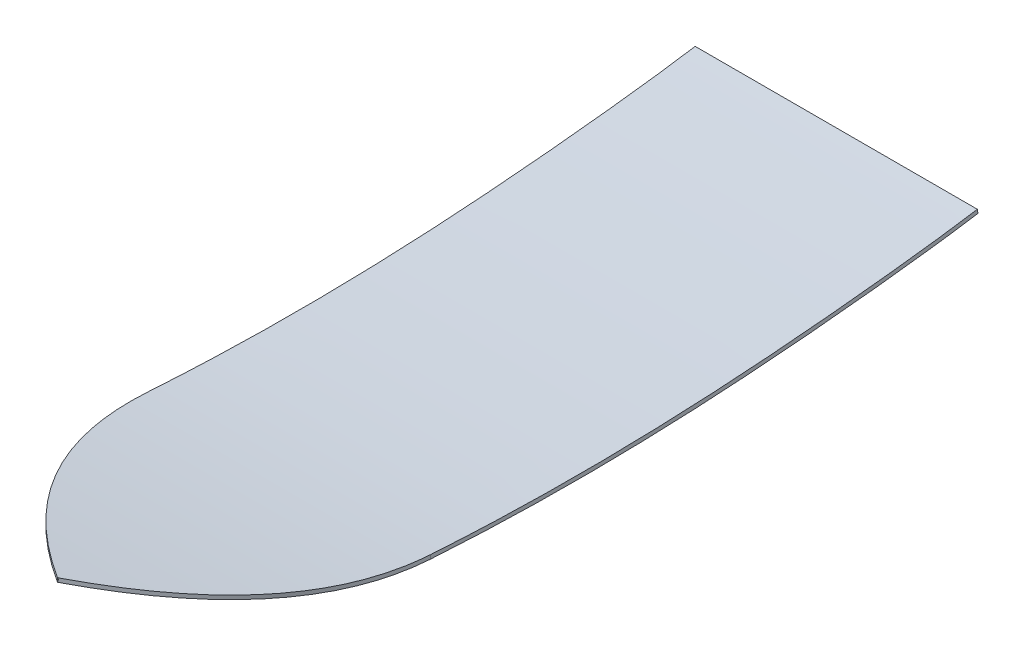
from build123d import *

# Parameters (mm, degrees)
BOSS_EXTRUDE1_DEPTH      = 1524
BOSS_EXTRUDE1_DEPTH_BACK = 1524
CUT_EXTRUDE1_DEPTH       = 4045.555232676
CUT_EXTRUDE1_DEPTH_BACK  = 4045.555232676
SKETCH3_W                = 5731.45735109
SKETCH3_H                = 8003.30588206


with BuildPart() as part:
    # Sketch1 → Boss-Extrude1 (new, two sides: drawn at the far end of the back side and taken through both)
    with BuildSketch(Plane(origin=(0, 0, 0), x_dir=(0, 0, -1), z_dir=(1, 0, 0)).offset(-BOSS_EXTRUDE1_DEPTH_BACK)):
        with BuildLine():
            Line((-3738.598348924, 39.976224385), (-3742.25554095, 15.245172113))
            add(Edge.make_bspline(
                [(-3742.25554095, 15.245172113), (-3725.535118437, 12.77258036), (-3692.108405138, 7.864272652), (-3625.081125069, -1.834737676), (-3541.2258593, -13.692342309), (-3440.832874878, -27.419661101), (-3307.81548506, -44.960095833), (-3144.009720726, -65.313134762), (-2953.851997478, -86.90871838), (-2771.660767492, -105.613608298), (-2627.128036737, -118.872843365), (-2515.948199802, -128.18745139), (-2434.744178293, -134.559022515), (-2355.713401147, -140.346054437), (-2278.724534954, -145.587189882), (-2202.959984942, -150.360148577), (-2103.436566601, -156.126098926), (-1981.389400261, -162.274499475), (-1837.600874635, -168.096757909), (-1695.574461023, -172.458706477), (-1554.543571859, -175.423410079), (-1413.822671965, -177.031022304), (-1272.806717473, -177.288564618), (-1130.885731445, -176.20268196), (-987.464309604, -173.74070399), (-841.946280225, -169.870399132), (-693.686505709, -164.526859425), (-567.265075864, -158.775674393), (-464.004662305, -153.339279499), (-385.394402347, -148.827140799), (-305.495597168, -143.861363386), (-224.132634072, -138.413188264), (-142.131592105, -132.539762269), (-32.15611158, -124.178968318), (105.905281407, -112.813198927), (270.631498183, -97.958115966), (432.472435932, -82.145845906), (589.461739236, -65.641348221), (714.583229245, -51.535715918), (810.253409693, -40.178384478), (879.541765579, -31.65843955), (946.115102109, -23.170995696), (1009.725395408, -14.750909824), (1060.058812021, -7.819198224), (1098.597377592, -2.342063803), (1126.606628964, 1.727405119), (1153.690591605, 5.754231394), (1175.464490045, 9.070928966), (1192.390191301, 11.698701882), (1204.835769764, 13.656512235), (1214.99075838, 15.275774902), (1222.99653812, 16.565774719), (1226.936863675, 17.205207674), (1228.914572093, 17.527310931)],
                knots=[0.002321773, 0.002321773, 0.002321773, 0.002321773, 0.010116134, 0.017910495, 0.033499218, 0.04908794, 0.064676662, 0.095854107, 0.127031551, 0.158208996, 0.189386441, 0.204975163, 0.220563885, 0.236152608, 0.25174133, 0.267330052, 0.282918774, 0.314096219, 0.345273664, 0.376451108, 0.407628553, 0.438805997, 0.469983442, 0.501160887, 0.532338331, 0.563515776, 0.59469322, 0.625870665, 0.641459387, 0.65704811, 0.672636832, 0.688225554, 0.703814276, 0.719402999, 0.750580443, 0.781757888, 0.812935332, 0.844112777, 0.875290222, 0.890878944, 0.906467666, 0.922056389, 0.937645111, 0.953233833, 0.961028194, 0.968822555, 0.976616917, 0.984411278, 0.988308458, 0.992205639, 0.996102819, 0.99805141, 1, 1, 1, 1], degree=3))
            Line((1228.914572093, 17.527310931), (1224.895850096, 42.202194386))
            add(Edge.make_bspline(
                [(-3738.598348924, 39.976224385), (-3676.666778775, 30.817873902), (-3580.81955157, 17.012727675), (-3418.185160468, -5.336634051), (-3285.265361645, -22.62937704), (-3122.318895953, -42.564326026), (-2963.29714227, -60.7391358), (-2780.409892732, -79.643113745), (-2606.285785501, -95.73370875), (-2475.50859426, -106.406899131), (-2396.719636239, -112.276343433), (-2370.525298258, -114.162302208), (-2341.156557247, -116.257886083), (-2314.566938882, -118.092203926), (-2237.899999276, -123.186335353), (-2134.379241461, -129.495244284), (-1987.664597818, -136.962681258), (-1843.676916626, -142.863792574), (-1701.498696065, -147.296450855), (-1513.302677865, -151.33487318), (-1278.906300228, -152.977989022), (-1041.55685732, -150.131491017), (-847.504929406, -145.032109855), (-699.233916307, -139.732235453), (-547.523057262, -132.872363549), (-417.563998872, -125.761937051), (-311.044851243, -119.167316489), (-229.66260201, -113.73635077), (-92.901025295, -103.968840297), (73.185712867, -90.647619918), (265.632655239, -73.318330387), (427.726706155, -57.499514534), (637.389616076, -35.477339541), (931.307069357, -1.168272104), (1130.712561152, 26.862853241), (1224.895850096, 42.202194386)],
                knots=[0.002321773, 0.002321773, 0.002321773, 0.002321773, 0.03125, 0.046875, 0.078125, 0.09375, 0.125, 0.15625, 0.1875, 0.21875, 0.23046875, 0.233886719, 0.234375, 0.248046875, 0.25, 0.28125, 0.3125, 0.34375, 0.375, 0.40625, 0.46875, 0.53125, 0.5625, 0.59375, 0.625, 0.65625, 0.671875, 0.6875, 0.703125, 0.75, 0.78125, 0.8125, 0.84375, 0.90625, 1, 1, 1, 1], degree=3))
        make_face()
    extrude(amount=BOSS_EXTRUDE1_DEPTH + BOSS_EXTRUDE1_DEPTH_BACK)

    # Sketch3 → Cut-Extrude1 (cut, two sides: drawn at the far end of the back side and taken through both)
    with BuildSketch(Plane(origin=(0, 0, 0), x_dir=(1, 0, 0), z_dir=(0, 1, 0)).offset(-CUT_EXTRUDE1_DEPTH_BACK)):
        with Locations((-68.47307406, 83.588987295)):
            Rectangle(SKETCH3_W, SKETCH3_H)
        with BuildLine():
            Line((-900, 1254.98047123), (900, 1254.98047123))
            Line((900, 1254.98047123), (900, -2262.553179323))
            add(Edge.make_bspline(
                [(900, -2262.553179323), (900, -3137.191784506), (0, -3742.25554095)],
                knots=[0, 0, 0, 1, 1, 1], degree=2))
            add(Edge.make_bspline(
                [(-900, -2262.553179323), (-900, -3137.191784506), (0, -3742.25554095)],
                knots=[0, 0, 0, 1, 1, 1], degree=2))
            Line((-900, -2262.553179323), (-900, 1254.98047123))
        make_face(mode=Mode.SUBTRACT)
    extrude(amount=CUT_EXTRUDE1_DEPTH + CUT_EXTRUDE1_DEPTH_BACK, mode=Mode.SUBTRACT)


solid = part.part
